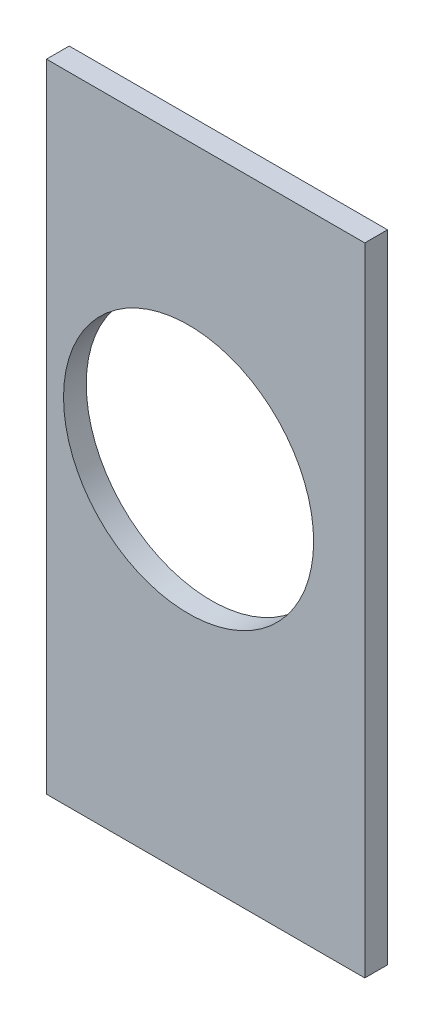
from build123d import *

# Parameters (mm, degrees)
ESQUISSE1_W                  = 140
ESQUISSE1_H                  = 280
BOSS_EXTRU_1_DEPTH           = 10
ENL_V_MAT_EXTRU_1_DEPTH      = 314.209195267
ENL_V_MAT_EXTRU_1_DEPTH_BACK = 314.209195267
ESQUISSE2_R                  = 55


with BuildPart() as part:
    # Esquisse1 → Boss.-Extru.1 (new body)
    with BuildSketch(Plane.XY):
        with Locations((70, 140)):
            Rectangle(ESQUISSE1_W, ESQUISSE1_H)
    extrude(amount=BOSS_EXTRU_1_DEPTH)

    # Esquisse2 → Enlèv. mat.-Extru.1 (cut, two sides: drawn at the far end of the back side and taken through both)
    with BuildSketch(Plane.XY.offset(10).offset(-ENL_V_MAT_EXTRU_1_DEPTH_BACK)):
        with Locations((62.5, 155)):
            Circle(ESQUISSE2_R)
    extrude(amount=ENL_V_MAT_EXTRU_1_DEPTH + ENL_V_MAT_EXTRU_1_DEPTH_BACK, mode=Mode.SUBTRACT)


solid = part.part
